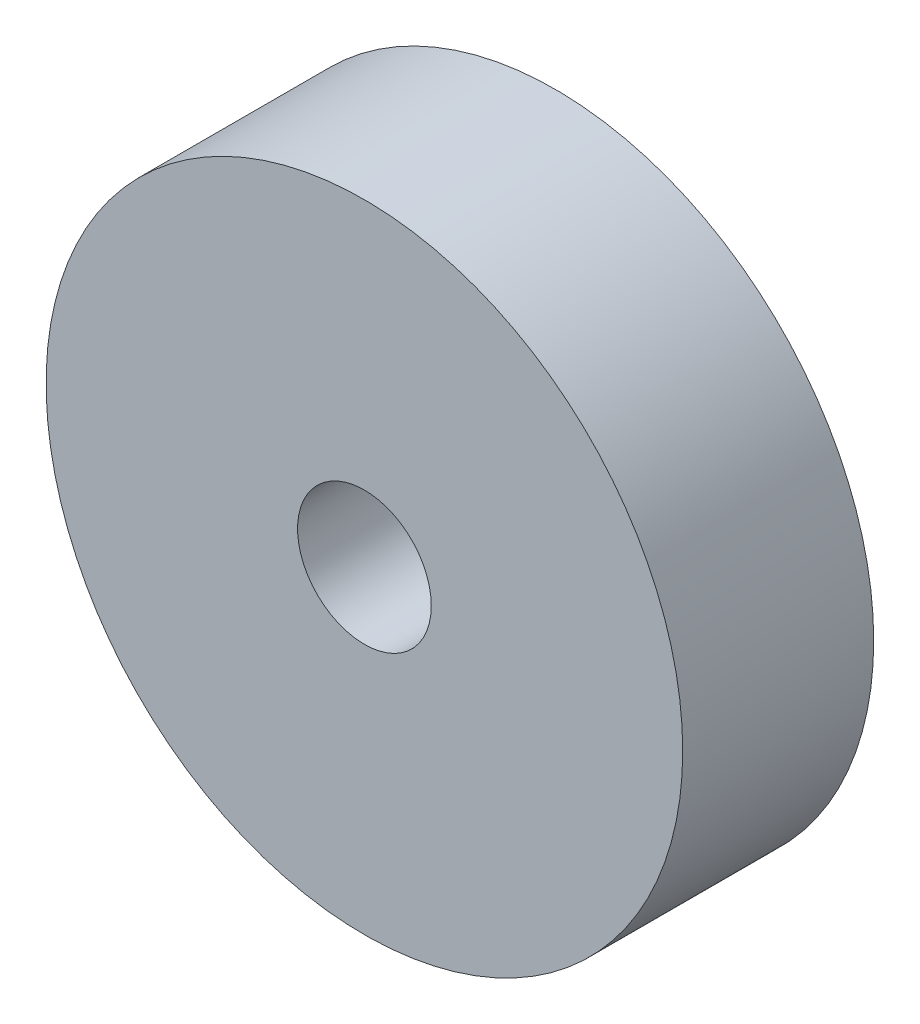
from build123d import *

# Parameters (mm, degrees)
SKETCH_1_R      = 10
SKETCH_1_R_2    = 2.1
EXTRUDE_1_DEPTH = 6


with BuildPart() as part:
    # 草图1 → 凸台-拉伸1 (new body)
    with BuildSketch(Plane.XY):
        Circle(SKETCH_1_R)
        Circle(SKETCH_1_R_2, mode=Mode.SUBTRACT)
    extrude(amount=EXTRUDE_1_DEPTH)


solid = part.part
